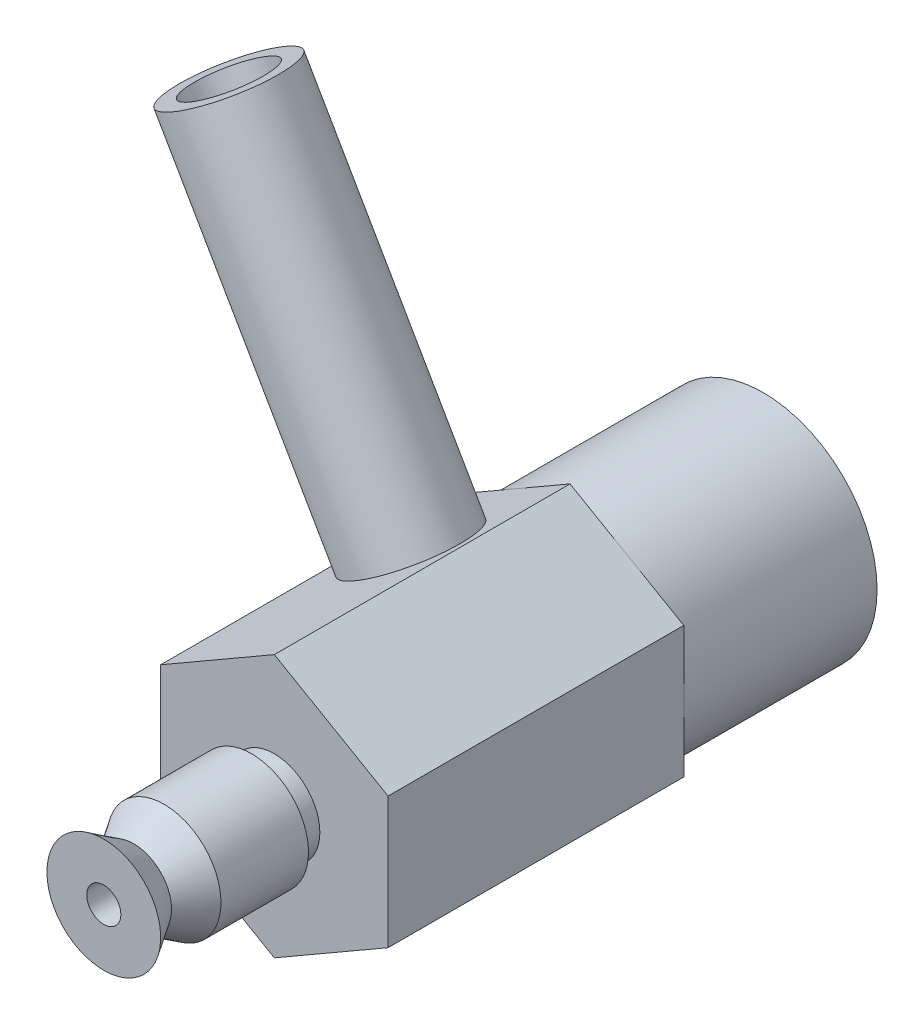
from build123d import *

# Parameters (mm, degrees)
SKETCH_1_R             = 5
EXTRUDE_1_DEPTH        = 8.5
EXTRUDE_2_DEPTH        = 13
SKETCH_3_R             = 2
EXTRUDE_3_DEPTH        = 1
SKETCH_5_R             = 0.75
CUT_EXTRUDE_1_DEPTH    = 15
SKETCH_6_R             = 2.5
EXTRUDE_4_DEPTH        = 16
SKETCH_7_R             = 1.75
CUT_EXTRUDE_2_DEPTH    = 22
HOLE_WIZARD_M4_1_D     = 3.3
HOLE_WIZARD_M4_1_DEPTH = 10.1
HOLE_WIZARD_M4_1_TIP   = 0.991420021


with BuildPart() as part:
    # 草图1 → 凸台-拉伸1 (new body)
    with BuildSketch(Plane.XY):
        Circle(SKETCH_1_R)
    extrude(amount=EXTRUDE_1_DEPTH)

    # 草图2 → 凸台-拉伸2 (add)
    with BuildSketch(Plane.XY.offset(8.5)):
        Polygon((5, 2.886751346), (0, 5.773502692), (-5, 2.886751346), (-5, -2.886751346), (0, -5.773502692), (5, -2.886751346), align=None)
    extrude(amount=EXTRUDE_2_DEPTH)

    # 草图3 → 凸台-拉伸3 (add)
    with BuildSketch(Plane.XY.offset(21.5)):
        Circle(SKETCH_3_R)
    extrude(amount=EXTRUDE_3_DEPTH)

    # 草图4 → 旋转1 (revolve)
    with BuildSketch(Plane(origin=(0, 0, 0), x_dir=(1, 0, 0), z_dir=(0, 1, 0)), mode=Mode.PRIVATE) as revolve_1_sk:
        Polygon((0, -22.5), (2.5, -22.5), (2.5, -26.347532538), (1.664204883, -27.683358747), (2.5, -29), (0, -29), align=None)
    revolve(revolve_1_sk.sketch.rotate(Axis((0, 0, 22.5), (0, 0, 1)), 180), axis=Axis((0, 0, 22.5), (0, 0, 1)))

    # 草图5 → 切除-拉伸1 (cut)
    with BuildSketch(Plane.XY.offset(29)):
        Circle(SKETCH_5_R)
    extrude(amount=-CUT_EXTRUDE_1_DEPTH, mode=Mode.SUBTRACT)

    # 草图6 → 凸台-拉伸4 (add)
    with BuildSketch(Plane(origin=(-2.5, 4.330127019, 0), x_dir=(0.8660254037844388, 0.49999999999999983, 0), z_dir=(-0.4999999999999998, 0.8660254037844387, 0))):
        with Locations((0, -13)):
            Circle(SKETCH_6_R)
    extrude(amount=EXTRUDE_4_DEPTH)

    # 草图7 → 切除-拉伸2 (cut)
    with BuildSketch(Plane(origin=(-10.5, 18.186533479, 0), x_dir=(0.8660254037844387, 0.49999999999999994, 0), z_dir=(-0.4999999999999999, 0.8660254037844386, 0))):
        with Locations(Location((0, -13, 0), (0, 0, 180))):
            Circle(SKETCH_7_R)
    extrude(amount=-CUT_EXTRUDE_2_DEPTH, mode=Mode.SUBTRACT)

    # M4 螺纹孔1
    with Locations(Plane(origin=(0, 0, 0), x_dir=(-1, 0, 0), z_dir=(0, 0, -1))):
        with Locations((0, 0)):
            Hole(HOLE_WIZARD_M4_1_D / 2, depth=HOLE_WIZARD_M4_1_DEPTH)
            with Locations((0, 0, -(HOLE_WIZARD_M4_1_DEPTH + HOLE_WIZARD_M4_1_TIP / 2))):  # 118° drill point
                Cone(0, HOLE_WIZARD_M4_1_D / 2, HOLE_WIZARD_M4_1_TIP, mode=Mode.SUBTRACT)


solid = part.part
